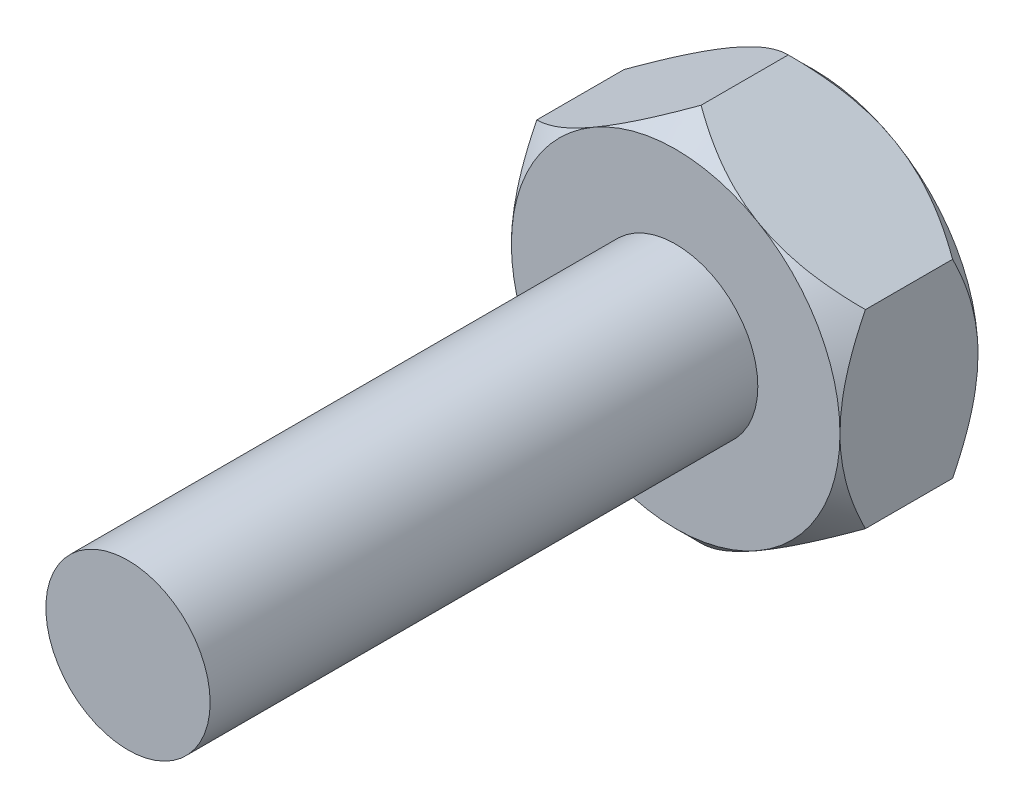
from build123d import *

# Parameters (mm, degrees)
SKETCH1_R           = 1.5
BOSS_EXTRUDE1_DEPTH = 10
BOSS_EXTRUDE3_DEPTH = 2.52
SKETCH7_OUTSIDE_W   = 39.768
SKETCH7_OUTSIDE_H   = 40.696
SKETCH7_OUTSIDE_R   = 3
CUT_EXTRUDE3_DEPTH  = 14.332306627
CUT_EXTRUDE3_DRAFT  = -45
SKETCH8_OUTSIDE_W   = 35.104
SKETCH8_OUTSIDE_H   = 36.032
SKETCH8_OUTSIDE_R   = 3
CUT_EXTRUDE5_DEPTH  = 12
CUT_EXTRUDE5_DRAFT  = -45


with BuildPart() as part:
    # Sketch1 → Boss-Extrude1 (new body)
    with BuildSketch(Plane.XY):
        Circle(SKETCH1_R)
    extrude(amount=BOSS_EXTRUDE1_DEPTH)

    # Sketch6 → Boss-Extrude3 (add)
    with BuildSketch(Plane(origin=(0, 0, 0), x_dir=(-1, 0, 0), z_dir=(0, 0, -1))):
        Polygon((0, -3.464101615), (3, -1.732050808), (3, 1.732050808), (0, 3.464101615), (-3, 1.732050808), (-3, -1.732050808), align=None)
    extrude(amount=BOSS_EXTRUDE3_DEPTH)


with BuildPart() as cut_extrude3_tool:
    # Sketch7 outside → Cut-Extrude3 (with draft: the straight prism first)
    with BuildSketch(Plane(origin=(0, 0, -2.52), x_dir=(-1, 0, 0), z_dir=(0, 0, -1))):
        Rectangle(SKETCH7_OUTSIDE_W, SKETCH7_OUTSIDE_H)
        Circle(SKETCH7_OUTSIDE_R, mode=Mode.SUBTRACT)
    extrude(amount=-CUT_EXTRUDE3_DEPTH)
    # Cut-Extrude3: the draft: its side faces are tilted about the plane it starts from
    cut_extrude3_sides = [cut_extrude3_tool.faces().sort_by_distance(p)[0] for p in [
        (0, -20.348, 4.646153314),
        (-19.884, 0, 4.646153314),
        (0, 20.348, 4.646153314),
        (19.884, 0, 4.646153314),
        (3, 0, 4.646153314),
    ]]
    draft(cut_extrude3_sides, Plane(origin=(0, 0, -2.52), x_dir=(-1, 0, 0), z_dir=(0, 0, -1)), CUT_EXTRUDE3_DRAFT)


with BuildPart() as part_1:
    add(part.part)

    # Cut-Extrude3: cut by cut_extrude3_tool
    add(cut_extrude3_tool.part, mode=Mode.SUBTRACT)


with BuildPart() as cut_extrude5_tool:
    # Sketch8 outside → Cut-Extrude5 (with draft: the straight prism first)
    with BuildSketch(Plane.XY):
        Rectangle(SKETCH8_OUTSIDE_W, SKETCH8_OUTSIDE_H)
        Circle(SKETCH8_OUTSIDE_R, mode=Mode.SUBTRACT)
    extrude(amount=-CUT_EXTRUDE5_DEPTH)
    # Cut-Extrude5: the draft: its side faces are tilted about the plane it starts from
    cut_extrude5_sides = [cut_extrude5_tool.faces().sort_by_distance(p)[0] for p in [
        (0, -18.016, -6),
        (17.552, 0, -6),
        (0, 18.016, -6),
        (-17.552, 0, -6),
        (-3, 0, -6),
    ]]
    draft(cut_extrude5_sides, Plane.XY, CUT_EXTRUDE5_DRAFT)


with BuildPart() as part_2:
    add(part_1.part)

    # Cut-Extrude5: cut by cut_extrude5_tool
    add(cut_extrude5_tool.part, mode=Mode.SUBTRACT)


solid = part_2.part
